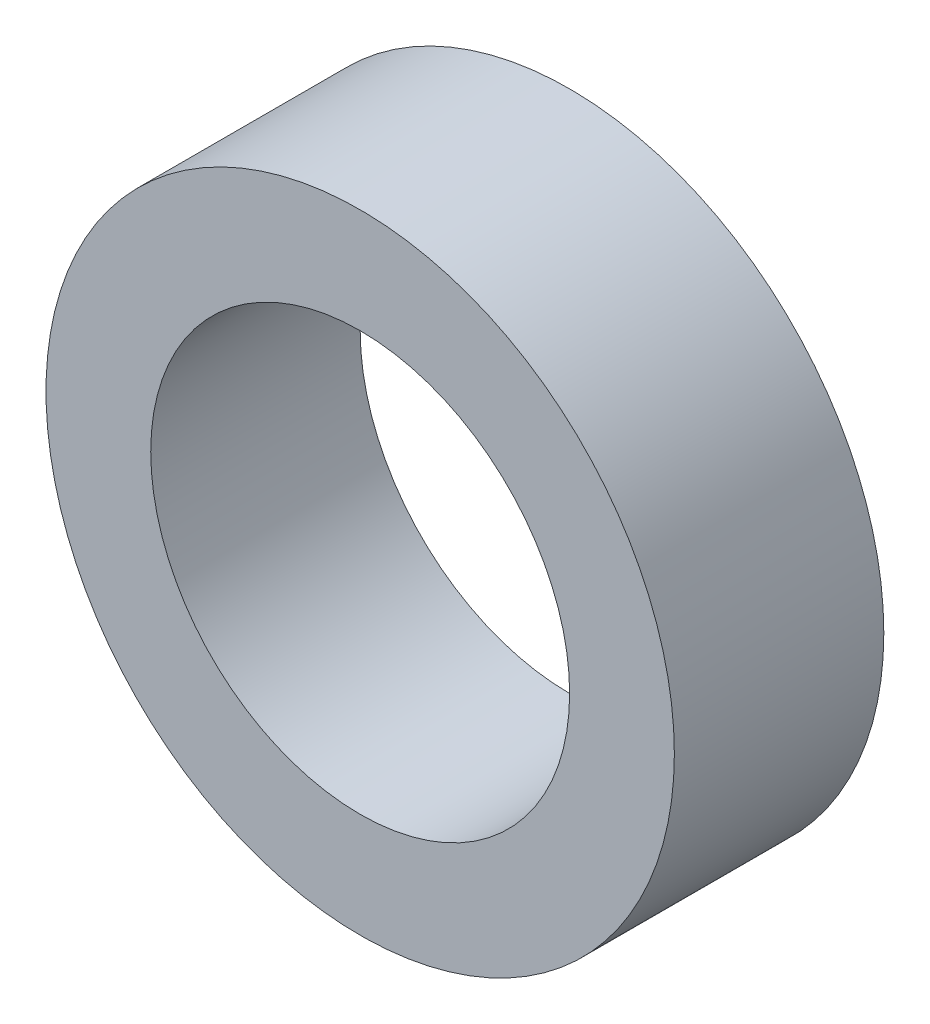
from build123d import *

# Parameters (mm, degrees)
SKETCH1_R           = 7.5
SKETCH1_R_2         = 5
BOSS_EXTRUDE1_DEPTH = 5


with BuildPart() as part:
    # Sketch1 → Boss-Extrude1 (new body)
    with BuildSketch(Plane.XY):
        Circle(SKETCH1_R)
        Circle(SKETCH1_R_2, mode=Mode.SUBTRACT)
    extrude(amount=BOSS_EXTRUDE1_DEPTH)


solid = part.part
